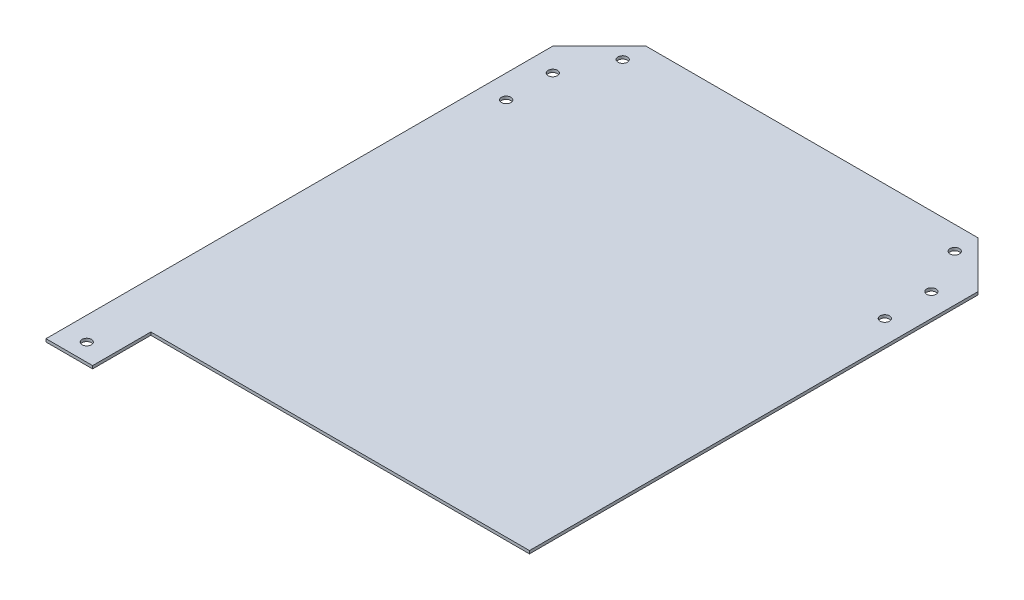
from build123d import *

# Parameters (mm, degrees)
BOSS_EXTRUDE1_DEPTH    = 1.5875
F_10_CLEARANCE_HOLE1_D = 5.1054


with BuildPart() as part:
    # Sketch3 → Boss-Extrude1 (new body)
    with BuildSketch(Plane(origin=(0, 0, 0), x_dir=(1, 0, 0), z_dir=(0, 1, 0))):
        Polygon((-96.156504736, -35.371535332), (-96.156504736, 240.853464665), (-70.756504733, 266.253464668), (110.218495843, 266.253464668), (135.618495843, 240.853464668), (135.618495843, -3.621535332), (-70.756504661, -3.621535332), (-70.756504661, -35.371535332), align=None)
    extrude(amount=BOSS_EXTRUDE1_DEPTH)

    # #10 Clearance Hole1 (through all)
    with Locations(Plane(origin=(0, 1.5875, 0), x_dir=(1, 0, 0), z_dir=(0, 1, 0))):
        with Locations((-83.456504705, -25.846534826), (-83.456504732, 202.753465682), (-83.456504732, 228.153465682), (-70.756504732, 253.553465682), (122.918495843, 202.753464668), (122.918495843, 228.153464668), (110.218495843, 253.553464668)):
            Hole(F_10_CLEARANCE_HOLE1_D / 2)


solid = part.part
